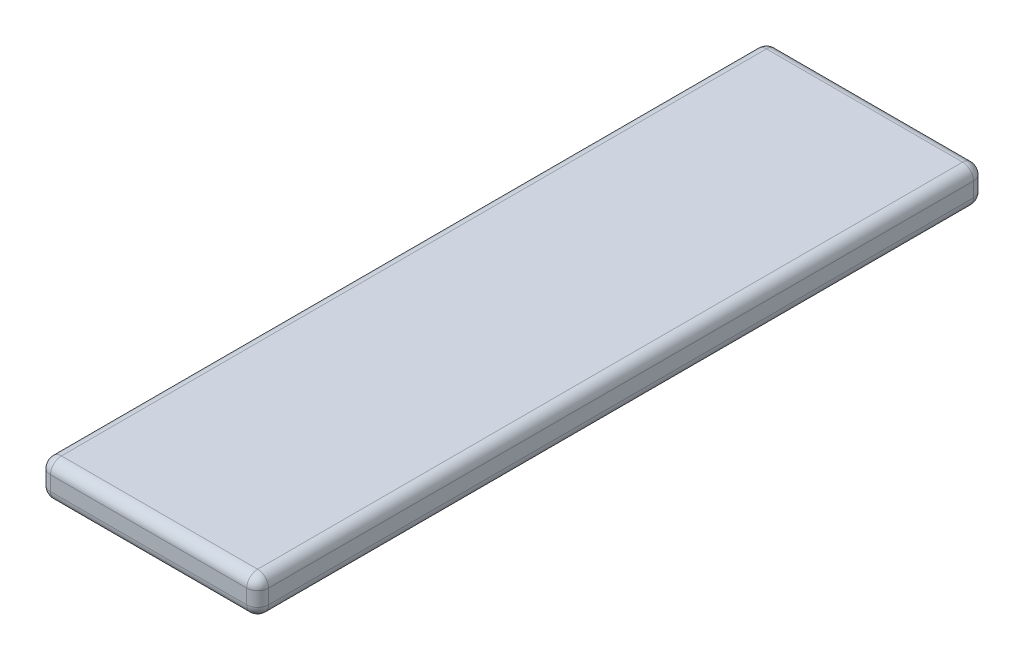
from build123d import *

# Parameters (mm, degrees)
SKETCH2_W           = 600
SKETCH2_H           = 2000
BOSS_EXTRUDE1_DEPTH = 100
FILLET1_R           = 30


with BuildPart() as part:
    # Sketch2 → Boss-Extrude1 (new body)
    with BuildSketch(Plane(origin=(0, 0, 0), x_dir=(1, 0, 0), z_dir=(0, 1, 0))):
        Rectangle(SKETCH2_W, SKETCH2_H)
    extrude(amount=BOSS_EXTRUDE1_DEPTH)

    # Fillet1
    fillet1_edges = [part.edges().sort_by_distance(p)[0] for p in [
        (300, 100, 0),
        (0, 100, -1000),
        (-300, 100, 0),
        (0, 0, -1000),
        (300, 0, 0),
        (0, 0, 1000),
        (-300, 0, 0),
        (-300, 50, -1000),
        (300, 50, -1000),
        (300, 50, 1000),
        (-300, 50, 1000),
        (0, 100, 1000),
    ]]
    fillet(fillet1_edges, radius=FILLET1_R)


solid = part.part
